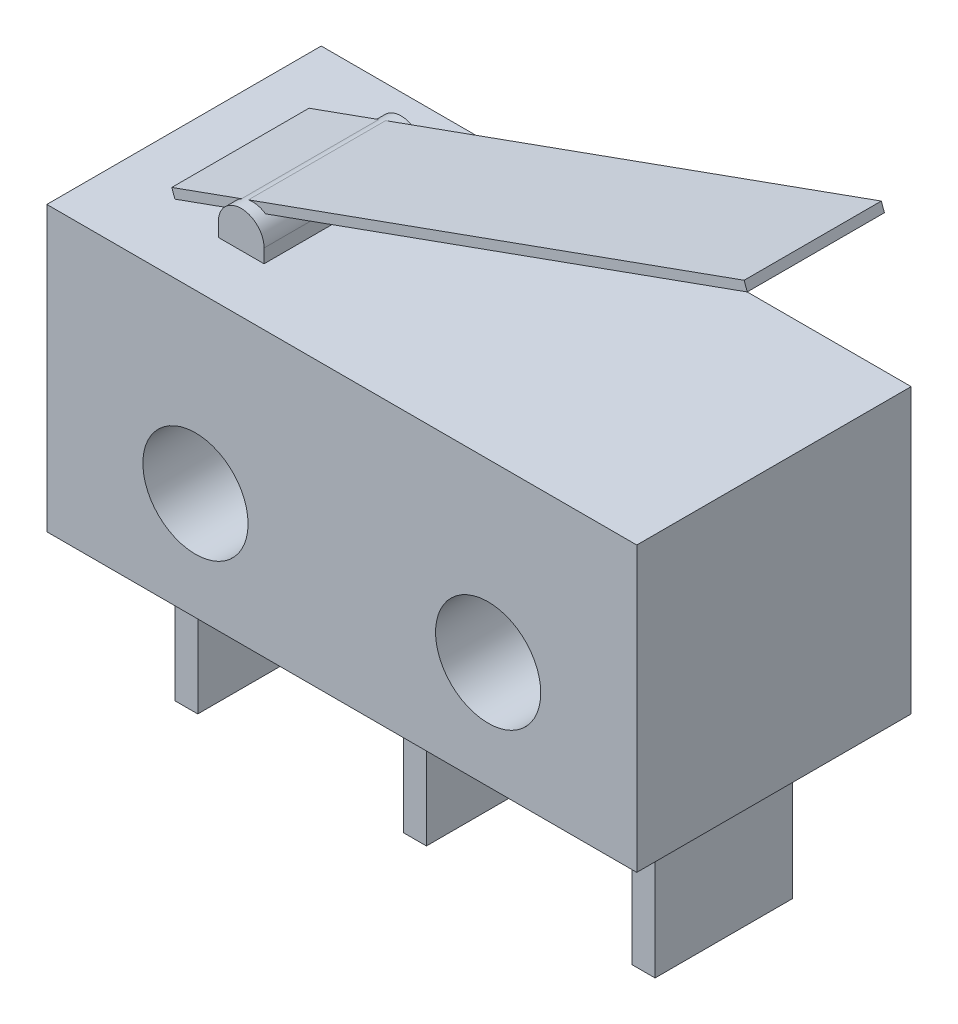
from build123d import *

# Parameters (mm, degrees)
ESBO_O1_W                  = 12.9
ESBO_O1_H                  = 6.2
RESSALTO_EXTRUS_O1_DEPTH   = 6
RESSALTO_EXTRUS_O2_DEPTH   = 1.75
CORTE_EXTRUS_O1_DEPTH      = 15.980320424
CORTE_EXTRUS_O1_DEPTH_BACK = 15.980320424
ESBO_O4_R                  = 1.15
ESBO_O5_W                  = 0.5
ESBO_O5_H                  = 3
RESSALTO_EXTRUS_O3_DEPTH   = 3.3
RESSALTO_EXTRUS_O8_DEPTH   = 1.5


with BuildPart() as part:
    # Esboço1 → Ressalto-extrusão1 (new body)
    with BuildSketch(Plane.XY):
        with Locations((-6.45, 3.1)):
            Rectangle(ESBO_O1_W, ESBO_O1_H)
    extrude(amount=RESSALTO_EXTRUS_O1_DEPTH)

    # Esboço3 → Ressalto-extrusão2 (add, symmetric)
    with BuildSketch(Plane.XY.offset(3)):
        with BuildLine():
            Line((-10.4, 6.2), (-9.4, 6.2))
            Line((-9.4, 6.2), (-9.4, 6.5))
            ThreePointArc((-9.4, 6.5), (-9.9, 7), (-10.4, 6.5))
            Line((-10.4, 6.5), (-10.4, 6.2))
        make_face()
    extrude(amount=RESSALTO_EXTRUS_O2_DEPTH, both=True)

    # Esboço4 → Corte-extrusão1 (cut, two sides: drawn at the far end of the back side and taken through both)
    with BuildSketch(Plane.XY.offset(3).offset(-CORTE_EXTRUS_O1_DEPTH_BACK)):
        with Locations((-3.25, 2.35)):
            Circle(ESBO_O4_R)
        with Locations((-9.65, 2.35)):
            Circle(ESBO_O4_R)
    extrude(amount=CORTE_EXTRUS_O1_DEPTH + CORTE_EXTRUS_O1_DEPTH_BACK, mode=Mode.SUBTRACT)

    # Esboço5 → Ressalto-extrusão3 (add)
    with BuildSketch(Plane.XZ):
        with Locations((-1.35, 3)):
            Rectangle(ESBO_O5_W, ESBO_O5_H)
        with Locations((-6.35, 3)):
            Rectangle(ESBO_O5_W, ESBO_O5_H)
        with Locations((-11.35, 3)):
            Rectangle(ESBO_O5_W, ESBO_O5_H)
    extrude(amount=RESSALTO_EXTRUS_O3_DEPTH)


with BuildPart() as body_2:
    # Esboço6 → Ressalto-extrusão8 (new, symmetric)
    with BuildSketch(Plane.XY.offset(3)):
        Polygon((-11.6, 6.2), (0.915590278, 10.7), (0.847921105, 10.888204365), (-11.667669173, 6.388204365), align=None)
    extrude(amount=RESSALTO_EXTRUS_O8_DEPTH, both=True)


solid = Compound([part.part, body_2.part])
